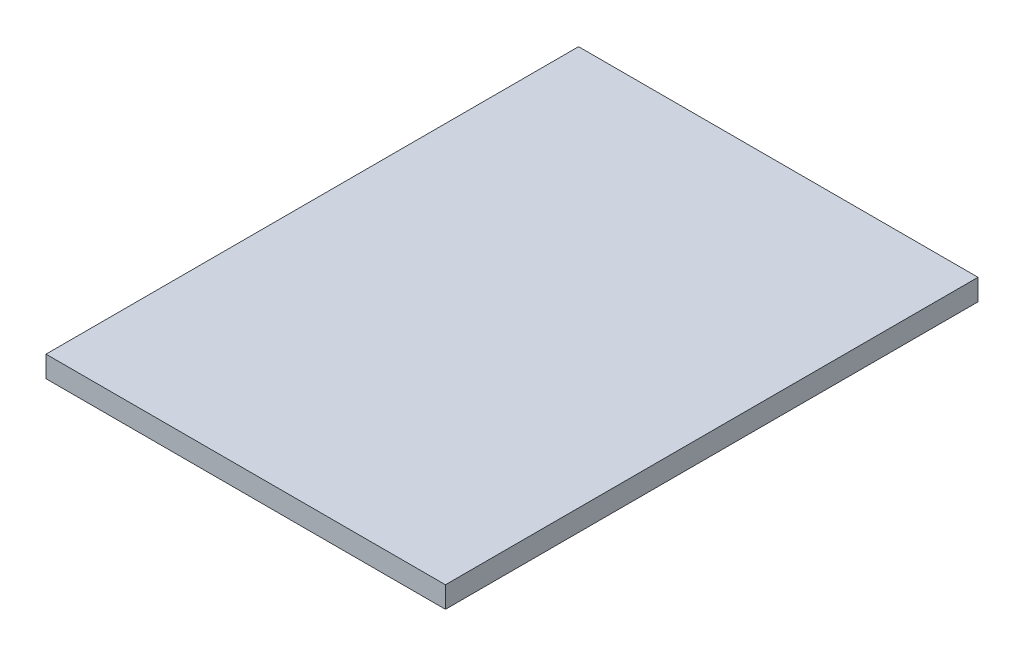
from build123d import *

# Parameters (mm, degrees)
EXTRUDE_2_DEPTH = 4


with BuildPart() as part:
    # Sketch 1 → Бобышка-Вытянуть2 (new body)
    with BuildSketch(Plane(origin=(105.635806819, 10, 21.814974173), x_dir=(0.6000000000000002, 0, 0.7999999999999999), z_dir=(0, 1, 0))):
        Polygon((0, 0), (45, 60), (125, 0), (80, -60), align=None)
    extrude(amount=EXTRUDE_2_DEPTH)


solid = part.part
